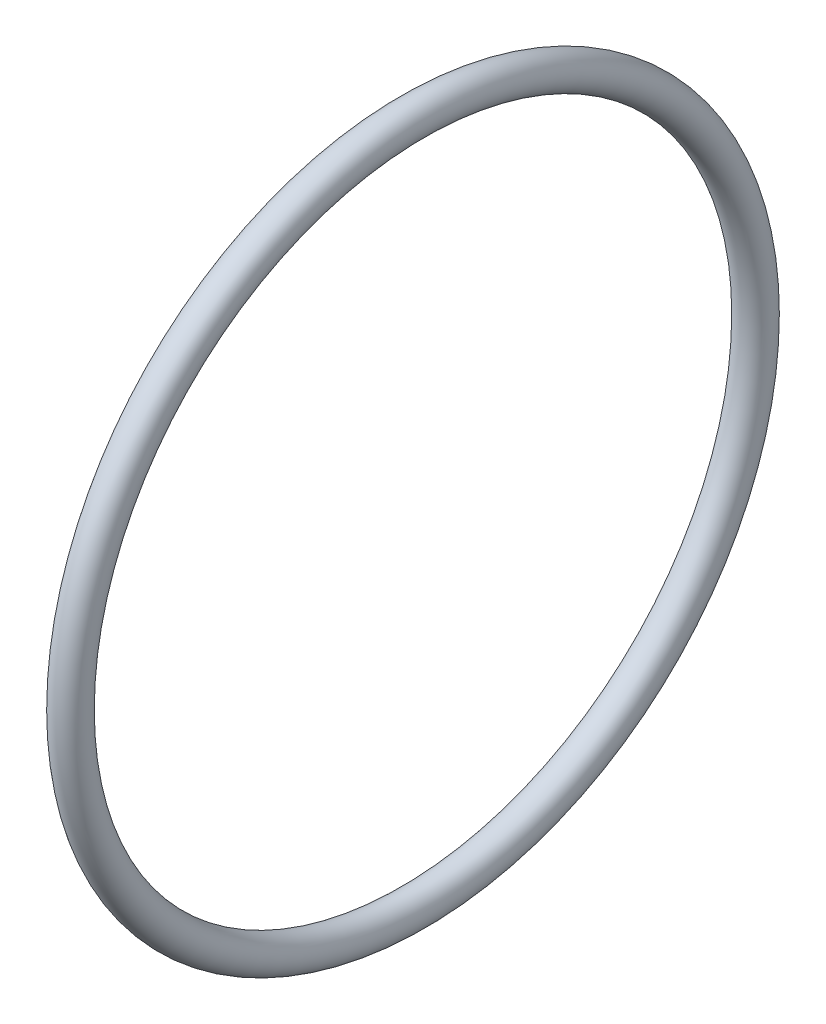
from build123d import *

# Parameters (mm, degrees)
ESQUISSE1_R = 0.75


with BuildPart() as part:
    # joint: sweep along a path in Esquisse2
    with BuildLine(Plane(origin=(0, 0, 0), x_dir=(0, 0, -1), z_dir=(1, 0, 0))) as joint_path:
        CenterArc((0, -15.25), 14.5, 0, 360)
    # Esquisse1 → joint (sweep)
    with BuildSketch(Plane.XY):
        Circle(ESQUISSE1_R)
    sweep(path=joint_path.line)


solid = part.part
